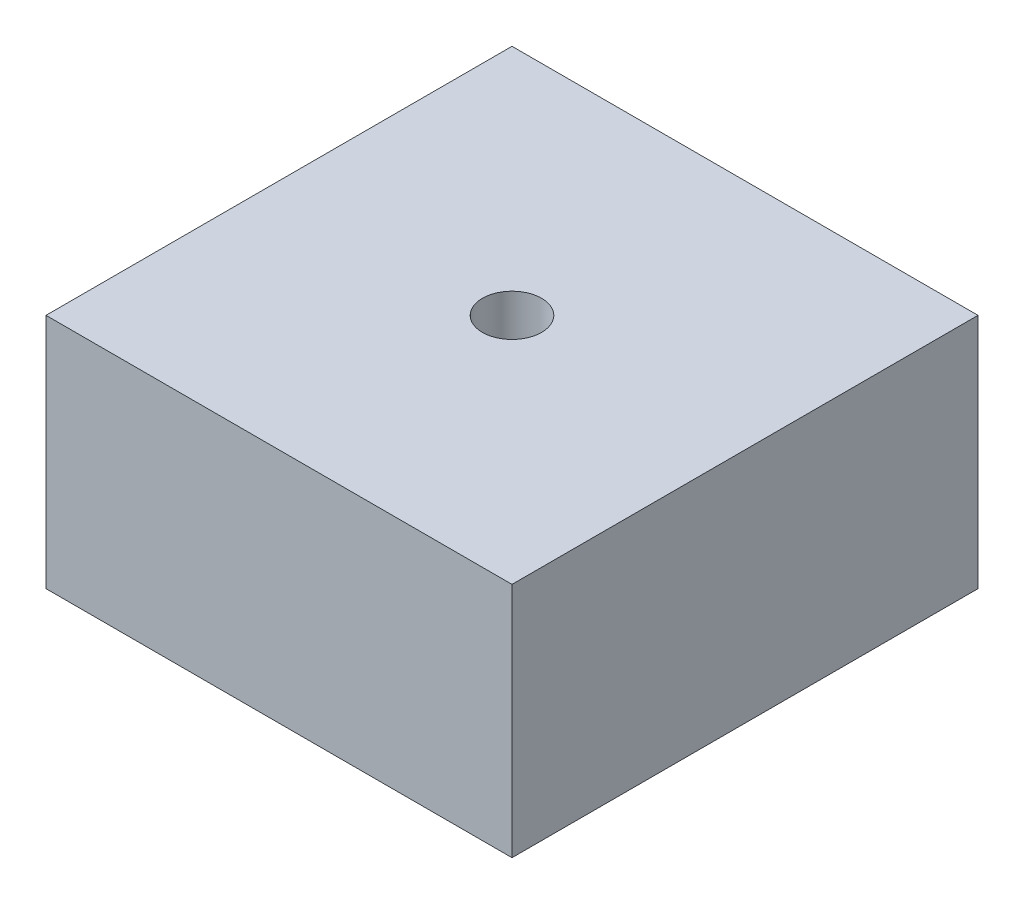
from build123d import *

# Parameters (mm, degrees)
SKETCH1_W           = 25
SKETCH1_H           = 25
BOSS_EXTRUDE1_DEPTH = 6.35
SKETCH2_R           = 1.5875
HOLE_DEPTH          = 22.766717713


with BuildPart() as part:
    # Sketch1 → Boss-Extrude1 (new, symmetric)
    with BuildSketch(Plane(origin=(0, 0, 0), x_dir=(1, 0, 0), z_dir=(0, 1, 0))):
        Rectangle(SKETCH1_W, SKETCH1_H)
    extrude(amount=BOSS_EXTRUDE1_DEPTH, both=True)

    # Sketch2 → Hole (cut, through all)
    with BuildSketch(Plane(origin=(0, 6.35, 0), x_dir=(1, 0, 0), z_dir=(0, 1, 0))):
        with Locations(Location((0, 0, 0), (0, 0, 270))):
            Circle(SKETCH2_R)
    extrude(amount=-HOLE_DEPTH, mode=Mode.SUBTRACT)


solid = part.part
